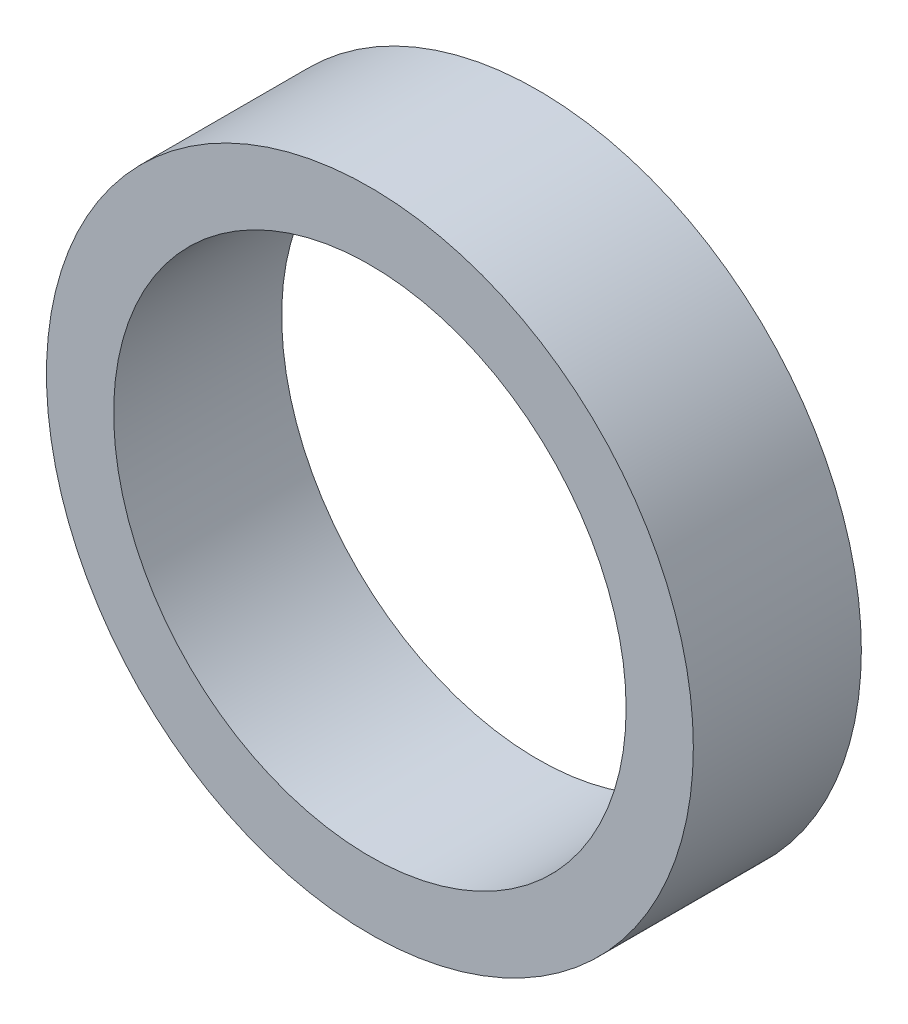
from build123d import *

# Parameters (mm, degrees)
SKETCH_1_R      = 1.925
SKETCH_1_R_2    = 1.525
EXTRUDE_1_DEPTH = 1


with BuildPart() as part:
    # 草图1 → 凸台-拉伸1 (new body)
    with BuildSketch(Plane.XY):
        Circle(SKETCH_1_R)
        Circle(SKETCH_1_R_2, mode=Mode.SUBTRACT)
    extrude(amount=EXTRUDE_1_DEPTH)


solid = part.part
